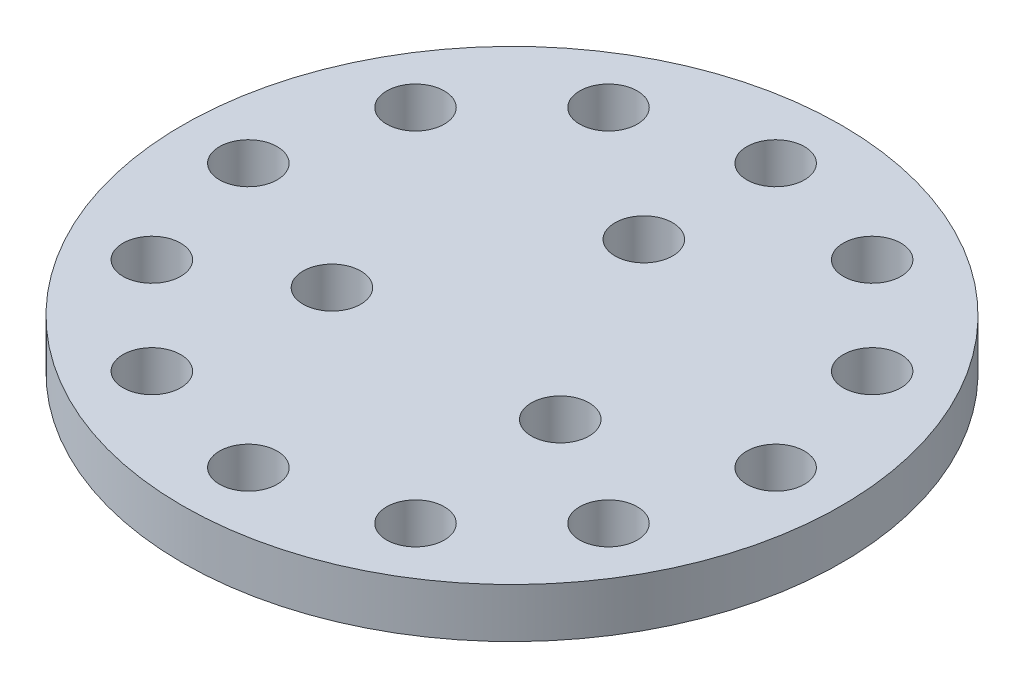
from build123d import *

# Parameters (mm, degrees)
ESBO_O1_R                = 20
ESBO_O1_R_2              = 1.75
RESSALTO_EXTRUS_O1_DEPTH = 3


with BuildPart() as part:
    # Esboço1 → Ressalto-extrusão1 (new body)
    with BuildSketch(Plane(origin=(0, 0, 0), x_dir=(1, 0, 0), z_dir=(0, 1, 0))):
        with Locations(Location((0, 0, 0), (0, 0, 270))):
            Circle(ESBO_O1_R)
        with Locations(Location((-8, 13.856406461, 0), (0, 0, 270))):
            Circle(ESBO_O1_R_2, mode=Mode.SUBTRACT)
        with Locations(Location((-13.856406461, 8, 0), (0, 0, 270))):
            Circle(ESBO_O1_R_2, mode=Mode.SUBTRACT)
        with Locations(Location((-16, 0, 0), (0, 0, 270))):
            Circle(ESBO_O1_R_2, mode=Mode.SUBTRACT)
        with Locations(Location((-13.856406461, -8, 0), (0, 0, 270))):
            Circle(ESBO_O1_R_2, mode=Mode.SUBTRACT)
        with Locations(Location((-8, -13.856406461, 0), (0, 0, 270))):
            Circle(ESBO_O1_R_2, mode=Mode.SUBTRACT)
        with Locations(Location((8, -13.856406461, 0), (0, 0, 270))):
            Circle(ESBO_O1_R_2, mode=Mode.SUBTRACT)
        with Locations(Location((0, -16, 0), (0, 0, 270))):
            Circle(ESBO_O1_R_2, mode=Mode.SUBTRACT)
        with Locations(Location((13.856406461, -8, 0), (0, 0, 270))):
            Circle(ESBO_O1_R_2, mode=Mode.SUBTRACT)
        with Locations(Location((16, 0, 0), (0, 0, 270))):
            Circle(ESBO_O1_R_2, mode=Mode.SUBTRACT)
        with Locations(Location((13.856406461, 8, 0), (0, 0, 270))):
            Circle(ESBO_O1_R_2, mode=Mode.SUBTRACT)
        with Locations(Location((8, 13.856406461, 0), (0, 0, 270))):
            Circle(ESBO_O1_R_2, mode=Mode.SUBTRACT)
        with Locations(Location((0, 16, 0), (0, 0, 270))):
            Circle(ESBO_O1_R_2, mode=Mode.SUBTRACT)
        with Locations(Location((0, 8, 0), (0, 0, 270))):
            Circle(ESBO_O1_R_2, mode=Mode.SUBTRACT)
        with Locations(Location((-6.92820323, -4, 0), (0, 0, 270))):
            Circle(ESBO_O1_R_2, mode=Mode.SUBTRACT)
        with Locations(Location((6.92820323, -4, 0), (0, 0, 270))):
            Circle(ESBO_O1_R_2, mode=Mode.SUBTRACT)
    extrude(amount=RESSALTO_EXTRUS_O1_DEPTH)


solid = part.part
